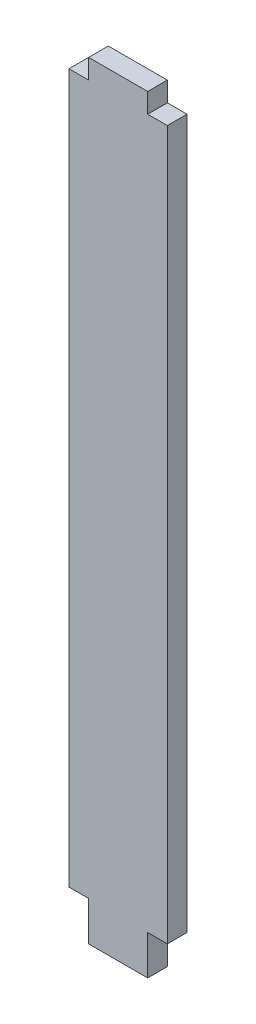
from build123d import *

# Parameters (mm, degrees)
BOSS_EXTRUDE1_DEPTH = 5


with BuildPart() as part:
    # Sketch1 → Boss-Extrude1 (new body)
    with BuildSketch(Plane.XY):
        Polygon((214.630903417, 191.207377047), (214.630903417, 11.207377047), (219.630903417, 11.207377047), (219.630903417, 1.207377047), (234.630903417, 1.207377047), (234.630903417, 11.207377047), (239.630903417, 11.207377047), (239.630903417, 191.207377047), (234.630903417, 191.207377047), (234.630903417, 196.207377047), (219.630903417, 196.207377047), (219.630903417, 191.207377047), align=None)
    extrude(amount=-BOSS_EXTRUDE1_DEPTH)


solid = part.part
